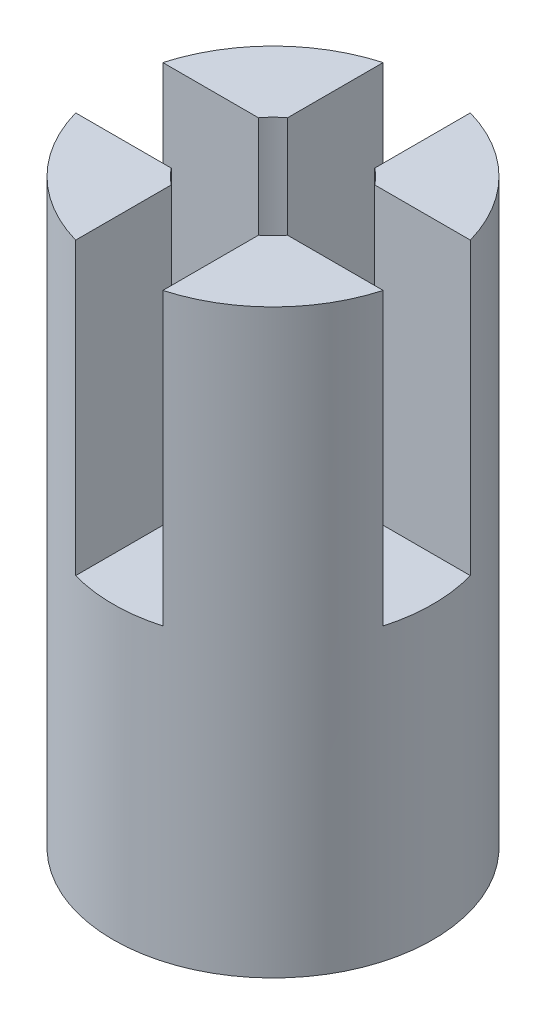
from build123d import *

# Parameters (mm, degrees)
ESQUISSE1_R             = 5.5
ESQUISSE1_R_2           = 2.5
BOSS_EXTRU_1_DEPTH      = 20
ENL_V_MAT_EXTRU_1_DEPTH = 10


with BuildPart() as part:
    # Esquisse1 → Boss.-Extru.1 (new body)
    with BuildSketch(Plane(origin=(0, 0, 0), x_dir=(1, 0, 0), z_dir=(0, 1, 0))):
        with Locations(Location((0, 0, 0), (0, 0, 270))):
            Circle(ESQUISSE1_R)
        with Locations(Location((0, 0, 0), (0, 0, 270))):
            Circle(ESQUISSE1_R_2, mode=Mode.SUBTRACT)
    extrude(amount=BOSS_EXTRU_1_DEPTH)

    # Esquisse2 → Enlèv. mat.-Extru.1 (cut)
    with BuildSketch(Plane(origin=(0, 20, 0), x_dir=(1, 0, 0), z_dir=(0, 1, 0))):
        Polygon((-1.5, 5.80668977), (-1.5, 1.5), (-8.808638821, 1.5), (-9.18844746, -1.5), (-1.5, -1.5), (-1.5, -5.792081745), (1.5, -5.792081745), (1.5, -1.5), (7.78364435, -1.5), (7.981313964, 1.5), (1.5, 1.5), (1.5, 5.80668977), align=None)
    extrude(amount=-ENL_V_MAT_EXTRU_1_DEPTH, mode=Mode.SUBTRACT)


solid = part.part
